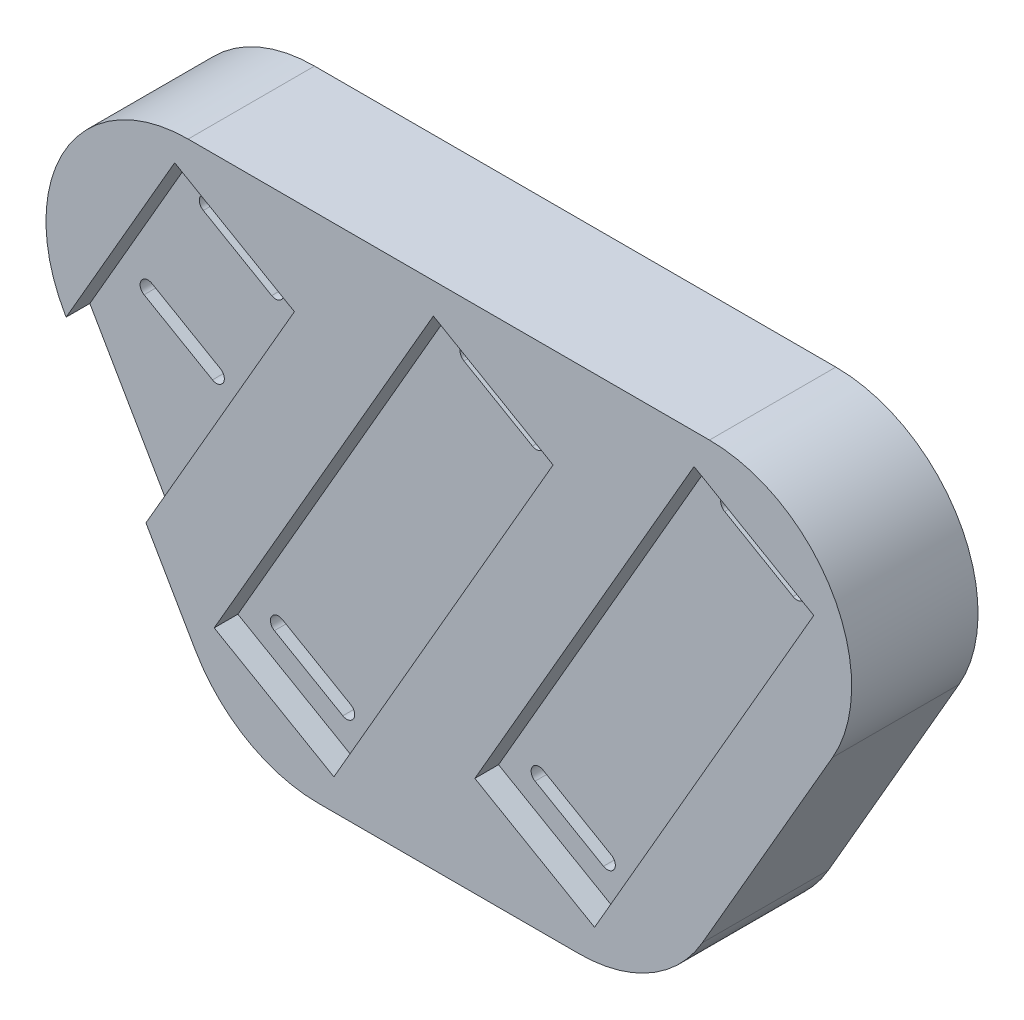
from build123d import *

# Parameters (mm, degrees)
SKETCH1_R           = 7.5
BOSS_EXTRUDE1_DEPTH = 5
SKETCH2_R           = 7.5
BOSS_EXTRUDE2_DEPTH = 1.5
BOSS_EXTRUDE3_DEPTH = 1.5


with BuildPart() as part:
    # Sketch1 → Boss-Extrude1 (new body)
    with BuildSketch(Plane.XY):
        with BuildLine():
            Line((7.794228634, -4.5), (-0.455771366, -18.789419162))
            ThreePointArc((-0.455771366, -18.789419162), (-3.75, -22.083647797), (-8.25, -23.289419162))
            Line((-8.25, -23.289419162), (-24.75, -23.289419162))
            ThreePointArc((-24.75, -23.289419162), (-29.25, -22.083647797), (-32.544228634, -18.789419162))
            Line((-32.544228634, -18.789419162), (-40.794228634, -4.5))
            ThreePointArc((-40.794228634, -4.5), (-40.794228634, 4.5), (-33, 9))
            Line((-33, 9), (0, 9))
            ThreePointArc((0, 9), (7.794228634, 4.5), (7.794228634, -4.5))
        make_face()
        with Locations((-24.75, -14.289419162)):
            Circle(SKETCH1_R, mode=Mode.SUBTRACT)
        with Locations((-16.5, 0)):
            Circle(SKETCH1_R, mode=Mode.SUBTRACT)
        Circle(SKETCH1_R, mode=Mode.SUBTRACT)
        with Locations((-8.25, -14.289419162)):
            Circle(SKETCH1_R, mode=Mode.SUBTRACT)
        with Locations((-33, 0)):
            Circle(SKETCH1_R, mode=Mode.SUBTRACT)
    extrude(amount=BOSS_EXTRUDE1_DEPTH)

    # Sketch2 → Boss-Extrude2 (add)
    # profile 1 of 6: a face of its own
    with BuildSketch(Plane.XY.offset(5)):
        with BuildLine():
            Line((-0.455771366, -18.789419162), (7.794228634, -4.5))
            ThreePointArc((7.794228634, -4.5), (7.794228634, 4.5), (0, 9))
            Line((0, 9), (-33, 9))
            ThreePointArc((-33, 9), (-40.794228634, 4.5), (-40.794228634, -4.5))
            Line((-40.794228634, -4.5), (-32.544228634, -18.789419162))
            ThreePointArc((-32.544228634, -18.789419162), (-29.25, -22.083647797), (-24.75, -23.289419162))
            Line((-24.75, -23.289419162), (-8.25, -23.289419162))
            ThreePointArc((-8.25, -23.289419162), (-3.75, -22.083647797), (-0.455771366, -18.789419162))
        make_face()
        Circle(SKETCH2_R, mode=Mode.SUBTRACT)
        with Locations((-16.5, 0)):
            Circle(SKETCH2_R, mode=Mode.SUBTRACT)
        with Locations((-33, 0)):
            Circle(SKETCH2_R, mode=Mode.SUBTRACT)
        with Locations((-24.75, -14.289419162)):
            Circle(SKETCH2_R, mode=Mode.SUBTRACT)
        with Locations((-8.25, -14.289419162)):
            Circle(SKETCH2_R, mode=Mode.SUBTRACT)
    # profile 2 of 6: a face of its own
    with BuildSketch(Plane.XY.offset(5)):
        with Locations((-8.25, -14.289419162)):
            Circle(SKETCH2_R)
        with BuildLine():
            ThreePointArc((-12.040063509, -15.854001725), (-12.723076211, -16.037014427), (-12.540063509, -16.720027129))
            Line((-12.540063509, -16.720027129), (-8.209936491, -19.220027129))
            ThreePointArc((-8.209936491, -19.220027129), (-7.526923789, -19.037014427), (-7.709936491, -18.354001725))
            Line((-7.709936491, -18.354001725), (-12.040063509, -15.854001725))
        make_face(mode=Mode.SUBTRACT)
    # profile 3 of 6: a face of its own
    with BuildSketch(Plane.XY.offset(5)):
        Circle(SKETCH2_R)
        with BuildLine():
            ThreePointArc((-0.040063509, 4.930607966), (-0.723076211, 4.747595264), (-0.540063509, 4.064582562))
            Line((-0.540063509, 4.064582562), (3.790063509, 1.564582562))
            ThreePointArc((3.790063509, 1.564582562), (4.473076211, 1.747595264), (4.290063509, 2.430607966))
            Line((4.290063509, 2.430607966), (-0.040063509, 4.930607966))
        make_face(mode=Mode.SUBTRACT)
    # profile 4 of 6: a face of its own
    with BuildSketch(Plane.XY.offset(5)):
        with Locations((-16.5, 0)):
            Circle(SKETCH2_R)
        with BuildLine():
            ThreePointArc((-16.540063509, 4.930607966), (-17.223076211, 4.747595264), (-17.040063509, 4.064582562))
            Line((-17.040063509, 4.064582562), (-12.709936491, 1.564582562))
            ThreePointArc((-12.709936491, 1.564582562), (-12.026923789, 1.747595264), (-12.209936491, 2.430607966))
            Line((-12.209936491, 2.430607966), (-16.540063509, 4.930607966))
        make_face(mode=Mode.SUBTRACT)
    # profile 5 of 6: a face of its own
    with BuildSketch(Plane.XY.offset(5)):
        with Locations((-24.75, -14.289419162)):
            Circle(SKETCH2_R)
        with BuildLine():
            ThreePointArc((-28.540063509, -15.854001725), (-29.223076211, -16.037014427), (-29.040063509, -16.720027129))
            Line((-29.040063509, -16.720027129), (-24.709936491, -19.220027129))
            ThreePointArc((-24.709936491, -19.220027129), (-24.026923789, -19.037014427), (-24.209936491, -18.354001725))
            Line((-24.209936491, -18.354001725), (-28.540063509, -15.854001725))
        make_face(mode=Mode.SUBTRACT)
    # profile 6 of 6: a face of its own
    with BuildSketch(Plane.XY.offset(5)):
        with Locations((-33, 0)):
            Circle(SKETCH2_R)
        with BuildLine():
            ThreePointArc((-36.790063509, -1.564582562), (-37.473076211, -1.747595264), (-37.290063509, -2.430607966))
            Line((-37.290063509, -2.430607966), (-32.959936491, -4.930607966))
            ThreePointArc((-32.959936491, -4.930607966), (-32.276923789, -4.747595264), (-32.459936491, -4.064582562))
            Line((-32.459936491, -4.064582562), (-36.790063509, -1.564582562))
        make_face(mode=Mode.SUBTRACT)
        with BuildLine():
            ThreePointArc((-33.040063509, 4.930607966), (-33.723076211, 4.747595264), (-33.540063509, 4.064582562))
            Line((-33.540063509, 4.064582562), (-29.209936491, 1.564582562))
            ThreePointArc((-29.209936491, 1.564582562), (-28.526923789, 1.747595264), (-28.709936491, 2.430607966))
            Line((-28.709936491, 2.430607966), (-33.040063509, 4.930607966))
        make_face(mode=Mode.SUBTRACT)
    extrude(amount=BOSS_EXTRUDE2_DEPTH)

    # Sketch3 → Boss-Extrude3 (add)
    with BuildSketch(Plane.XY.offset(6.5)):
        with BuildLine():
            ThreePointArc((-33, 9), (-40.794228634, 4.5), (-40.794228634, -4.5))
            Line((-40.794228634, -4.5), (-40.72205985, -4.625))
            Line((-40.72205985, -4.625), (-33.851361142, 7.275399247))
            Line((-33.851361142, 7.275399247), (-26.273638858, 2.900399247))
            Line((-26.273638858, 2.900399247), (-35.670244995, -13.375))
            Line((-35.670244995, -13.375), (-32.544228634, -18.789419162))
            ThreePointArc((-32.544228634, -18.789419162), (-29.25, -22.083647797), (-24.75, -23.289419162))
            Line((-24.75, -23.289419162), (-8.25, -23.289419162))
            ThreePointArc((-8.25, -23.289419162), (-3.75, -22.083647797), (-0.455771366, -18.789419162))
            Line((-0.455771366, -18.789419162), (7.794228634, -4.5))
            ThreePointArc((7.794228634, -4.5), (7.794228634, 4.5), (0, 9))
            Line((0, 9), (-33, 9))
        make_face()
        Polygon((-17.476361142, 7.058892896), (-9.898638858, 2.683892896), (-23.773638858, -21.348312059), (-31.351361142, -16.973312059), align=None, mode=Mode.SUBTRACT)
        Polygon((-0.976361142, 7.058892896), (6.601361142, 2.683892896), (-7.273638858, -21.348312059), (-14.851361142, -16.973312059), align=None, mode=Mode.SUBTRACT)
    extrude(amount=BOSS_EXTRUDE3_DEPTH)


solid = part.part
